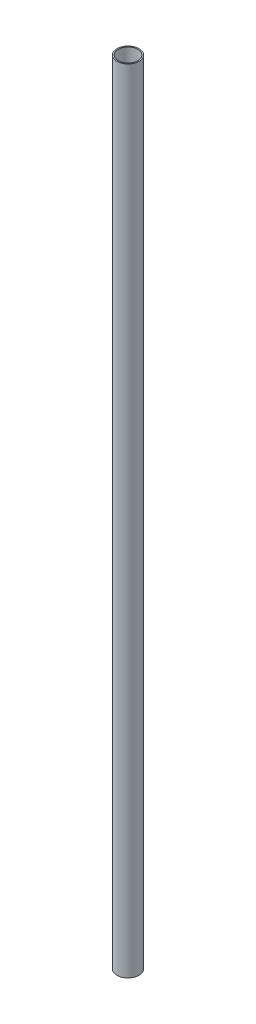
from build123d import *

# Parameters (mm, degrees)
SKETCH1_R           = 11.665
SKETCH1_R_2         = 10.395
BOSS_EXTRUDE1_DEPTH = 419.1


with BuildPart() as part:
    # Sketch1 → Boss-Extrude1 (new, symmetric)
    with BuildSketch(Plane(origin=(0, 0, 0), x_dir=(1, 0, 0), z_dir=(0, 1, 0))):
        with Locations(Location((0, 0, 0), (0, 0, 270))):
            Circle(SKETCH1_R)
        with Locations(Location((0, 0, 0), (0, 0, 270))):
            Circle(SKETCH1_R_2, mode=Mode.SUBTRACT)
    extrude(amount=BOSS_EXTRUDE1_DEPTH, both=True)


solid = part.part
